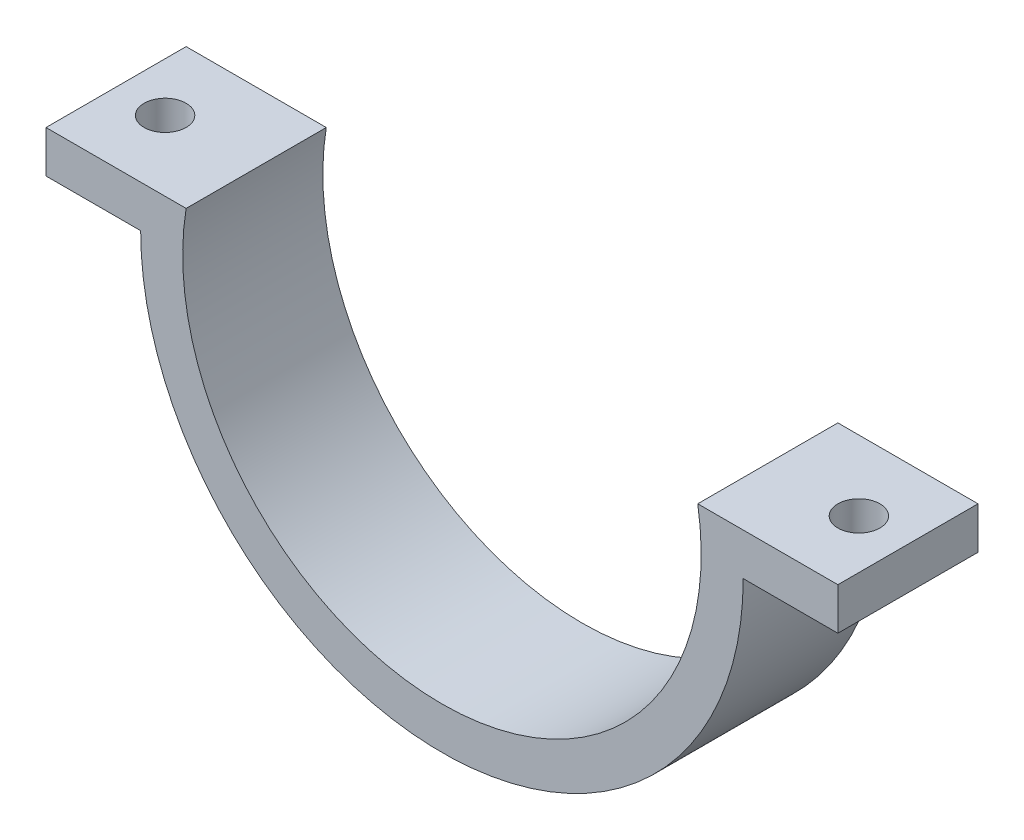
from build123d import *

# Parameters (mm, degrees)
BOSS_EXTRUDE1_DEPTH = 10
CUT_EXTRUDE1_DEPTH  = 3


with BuildPart() as part:
    # Sketch1 → Boss-Extrude1 (new body)
    with BuildSketch(Plane.XY):
        with BuildLine():
            ThreePointArc((18.5, 0), (-1.504988227, -18.438682449), (-18.255136264, 3))
            Line((-18.255136264, 3), (-28.255136264, 3))
            Line((-28.255136264, 3), (-28.255136264, 0))
            Line((-28.255136264, 0), (-21.5, 0))
            ThreePointArc((-21.5, 0), (0, -21.5), (21.5, 0))
            Line((21.5, 0), (28.255136264, 0))
            Line((28.255136264, 0), (28.255136264, 3))
            Line((28.255136264, 3), (18.255136264, 3))
            ThreePointArc((18.255136264, 3), (18.438682449, 1.504988227), (18.5, 0))
        make_face()
    extrude(amount=BOSS_EXTRUDE1_DEPTH)

    # Sketch2 → Cut-Extrude1 (cut)
    with BuildSketch(Plane(origin=(0, 3, 0), x_dir=(1, 0, 0), z_dir=(0, 1, 0))):
        with BuildLine():
            ThreePointArc((-23.255136264, -5), (-24.755136264, -3.5), (-26.255136264, -5))
            Line((-26.255136264, -5), (-23.255136264, -5))
        make_face()
        with BuildLine():
            Line((-23.255136264, -5), (-26.255136264, -5))
            ThreePointArc((-26.255136264, -5), (-24.755136264, -6.5), (-23.255136264, -5))
        make_face()
    cut_extrude1 = extrude(amount=-CUT_EXTRUDE1_DEPTH, mode=Mode.SUBTRACT)

    # Mirror1: Cut-Extrude1 across plane
    add(cut_extrude1.mirror(Plane(origin=(0, 0, 0), x_dir=(0, 0, 1), z_dir=(1, 0, 0))), mode=Mode.SUBTRACT)


solid = part.part
